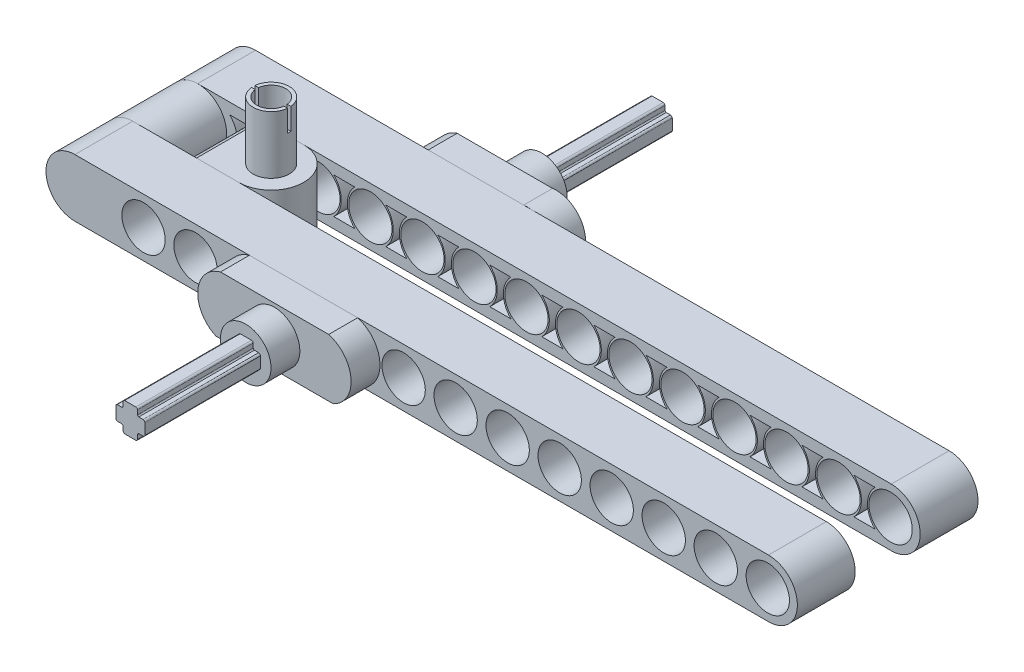
from build123d import *

# Parameters (mm, degrees)
BOSS_EXTRUDE1_DEPTH     = 8
SKETCH2_R               = 4
BOSS_EXTRUDE2_DEPTH     = 9
BOSS_EXTRUDE3_DEPTH     = 8
CUT_EXTRUDE4_DEPTH      = 55.854352608
CUT_EXTRUDE4_DEPTH_BACK = 55.854352608
SKETCH4_R               = 3
BOSS_EXTRUDE9_DEPTH     = 9
FILLET7_RADIUS          = 4.5
FILLET7_LENGTH          = 7.999994041
SKETCH33_R              = 2.5
SKETCH33_R_2            = 2
BOSS_EXTRUDE11_DEPTH    = 8
SKETCH34_W              = 5.22200927
SKETCH34_H              = 0.454292684
CUT_EXTRUDE17_DEPTH     = 3
BOSS_EXTRUDE12_DEPTH    = 4
BOSS_EXTRUDE16_DEPTH    = 4
SKETCH43_R              = 3.5
BOSS_EXTRUDE17_DEPTH    = 4
BOSS_EXTRUDE18_DEPTH    = 16
CUT_EXTRUDE18_DEPTH     = 2


with BuildPart() as part:
    # Sketch1 → Boss-Extrude1 (new body)
    with BuildSketch(Plane.XY):
        with BuildLine():
            Line((48, 4), (-48, 4))
            ThreePointArc((-48, 4), (-52, 0), (-48, -4))
            Line((-48, -4), (48, -4))
            ThreePointArc((48, -4), (52, 0), (48, 4))
        make_face()
    extrude(amount=-BOSS_EXTRUDE1_DEPTH)


with BuildPart() as body_2:
    # Sketch2 → Boss-Extrude2 (new body)
    with BuildSketch(Plane.XY):
        with Locations((-48, 0)):
            Circle(SKETCH2_R)
    extrude(amount=BOSS_EXTRUDE2_DEPTH)


with BuildPart() as body_3:
    # Sketch3 → Boss-Extrude3 (new body)
    with BuildSketch(Plane.XY.offset(9)):
        with BuildLine():
            Line((48, 4), (-48, 4))
            ThreePointArc((-48, 4), (-52, 0), (-48, -4))
            Line((-48, -4), (48, -4))
            ThreePointArc((48, -4), (52, 0), (48, 4))
        make_face()
    extrude(amount=BOSS_EXTRUDE3_DEPTH)


with BuildPart() as cut_extrude4_tool:
    # Sketch4 → Cut-Extrude4 (new, two sides: drawn at the far end of the back side and taken through both)
    with BuildSketch(Plane.XY.offset(-CUT_EXTRUDE4_DEPTH_BACK)):
        with Locations((-38.5, 0)):
            Circle(SKETCH4_R)
        with Locations((-31.3, 0)):
            Circle(SKETCH4_R)
        with Locations((-24.1, 0)):
            Circle(SKETCH4_R)
        with Locations((-16.9, 0)):
            Circle(SKETCH4_R)
        with Locations((-9.7, 0)):
            Circle(SKETCH4_R)
        with Locations((-2.5, 0)):
            Circle(SKETCH4_R)
        with Locations((4.7, 0)):
            Circle(SKETCH4_R)
        with Locations((11.9, 0)):
            Circle(SKETCH4_R)
        with Locations((19.1, 0)):
            Circle(SKETCH4_R)
        with Locations((26.3, 0)):
            Circle(SKETCH4_R)
        with Locations((33.5, 0)):
            Circle(SKETCH4_R)
        with Locations((40.7, 0)):
            Circle(SKETCH4_R)
        with Locations((47.9, 0)):
            Circle(SKETCH4_R)
    extrude(amount=CUT_EXTRUDE4_DEPTH + CUT_EXTRUDE4_DEPTH_BACK)


with BuildPart() as part_1:
    add(part.part)

    # Cut-Extrude4: cut by cut_extrude4_tool
    add(cut_extrude4_tool.part, mode=Mode.SUBTRACT)

    # Sketch12 → Cut-Extrude18 (cut)
    with BuildSketch(Plane.XY):
        with BuildLine():
            Line((-40.656780083, 2.479632802), (-43.571478062, 2.479632802))
            ThreePointArc((-43.571478062, 2.479632802), (-42.535944156, -0.020367198), (-43.571478062, -2.520367198))
            Line((-43.571478062, -2.520367198), (-40.656780083, -2.520367198))
            ThreePointArc((-40.656780083, -2.520367198), (-41.692313989, -0.020367198), (-40.656780083, 2.479632802))
        make_face()
        with BuildLine():
            Line((-33.456780083, 2.479632802), (-36.371478062, 2.479632802))
            ThreePointArc((-36.371478062, 2.479632802), (-35.335944156, -0.020367198), (-36.371478062, -2.520367198))
            Line((-36.371478062, -2.520367198), (-33.456780083, -2.520367198))
            ThreePointArc((-33.456780083, -2.520367198), (-34.492313989, -0.020367198), (-33.456780083, 2.479632802))
        make_face()
        with BuildLine():
            Line((-26.256780083, 2.479632802), (-29.171478062, 2.479632802))
            ThreePointArc((-29.171478062, 2.479632802), (-28.135944156, -0.020367198), (-29.171478062, -2.520367198))
            Line((-29.171478062, -2.520367198), (-26.256780083, -2.520367198))
            ThreePointArc((-26.256780083, -2.520367198), (-27.292313989, -0.020367198), (-26.256780083, 2.479632802))
        make_face()
        with BuildLine():
            Line((-19.056780083, 2.479632802), (-21.971478062, 2.479632802))
            ThreePointArc((-21.971478062, 2.479632802), (-20.935944156, -0.020367198), (-21.971478062, -2.520367198))
            Line((-21.971478062, -2.520367198), (-19.056780083, -2.520367198))
            ThreePointArc((-19.056780083, -2.520367198), (-20.092313989, -0.020367198), (-19.056780083, 2.479632802))
        make_face()
        with BuildLine():
            Line((-11.856780083, 2.479632802), (-14.771478062, 2.479632802))
            ThreePointArc((-14.771478062, 2.479632802), (-13.735944156, -0.020367198), (-14.771478062, -2.520367198))
            Line((-14.771478062, -2.520367198), (-11.856780083, -2.520367198))
            ThreePointArc((-11.856780083, -2.520367198), (-12.892313989, -0.020367198), (-11.856780083, 2.479632802))
        make_face()
        with BuildLine():
            Line((-4.656780083, 2.479632802), (-7.571478062, 2.479632802))
            ThreePointArc((-7.571478062, 2.479632802), (-6.535944156, -0.020367198), (-7.571478062, -2.520367198))
            Line((-7.571478062, -2.520367198), (-4.656780083, -2.520367198))
            ThreePointArc((-4.656780083, -2.520367198), (-5.692313989, -0.020367198), (-4.656780083, 2.479632802))
        make_face()
        with BuildLine():
            Line((2.543219917, 2.479632802), (-0.371478062, 2.479632802))
            ThreePointArc((-0.371478062, 2.479632802), (0.664055844, -0.020367198), (-0.371478062, -2.520367198))
            Line((-0.371478062, -2.520367198), (2.543219917, -2.520367198))
            ThreePointArc((2.543219917, -2.520367198), (1.507686011, -0.020367198), (2.543219917, 2.479632802))
        make_face()
        with BuildLine():
            Line((9.743219917, 2.479632802), (6.828521938, 2.479632802))
            ThreePointArc((6.828521938, 2.479632802), (7.864055844, -0.020367198), (6.828521938, -2.520367198))
            Line((6.828521938, -2.520367198), (9.743219917, -2.520367198))
            ThreePointArc((9.743219917, -2.520367198), (8.707686011, -0.020367198), (9.743219917, 2.479632802))
        make_face()
        with BuildLine():
            Line((16.943219917, 2.479632802), (14.028521938, 2.479632802))
            ThreePointArc((14.028521938, 2.479632802), (15.064055844, -0.020367198), (14.028521938, -2.520367198))
            Line((14.028521938, -2.520367198), (16.943219917, -2.520367198))
            ThreePointArc((16.943219917, -2.520367198), (15.907686011, -0.020367198), (16.943219917, 2.479632802))
        make_face()
        with BuildLine():
            Line((24.143219917, 2.479632802), (21.228521938, 2.479632802))
            ThreePointArc((21.228521938, 2.479632802), (22.264055844, -0.020367198), (21.228521938, -2.520367198))
            Line((21.228521938, -2.520367198), (24.143219917, -2.520367198))
            ThreePointArc((24.143219917, -2.520367198), (23.107686011, -0.020367198), (24.143219917, 2.479632802))
        make_face()
        with BuildLine():
            Line((31.343219917, 2.479632802), (28.428521938, 2.479632802))
            ThreePointArc((28.428521938, 2.479632802), (29.464055844, -0.020367198), (28.428521938, -2.520367198))
            Line((28.428521938, -2.520367198), (31.343219917, -2.520367198))
            ThreePointArc((31.343219917, -2.520367198), (30.307686011, -0.020367198), (31.343219917, 2.479632802))
        make_face()
        with BuildLine():
            Line((38.543219917, 2.479632802), (35.628521938, 2.479632802))
            ThreePointArc((35.628521938, 2.479632802), (36.664055844, -0.020367198), (35.628521938, -2.520367198))
            Line((35.628521938, -2.520367198), (38.543219917, -2.520367198))
            ThreePointArc((38.543219917, -2.520367198), (37.507686011, -0.020367198), (38.543219917, 2.479632802))
        make_face()
        with BuildLine():
            Line((45.743219917, 2.479632802), (42.828521938, 2.479632802))
            ThreePointArc((42.828521938, 2.479632802), (43.864055844, -0.020367198), (42.828521938, -2.520367198))
            Line((42.828521938, -2.520367198), (45.743219917, -2.520367198))
            ThreePointArc((45.743219917, -2.520367198), (44.707686011, -0.020367198), (45.743219917, 2.479632802))
        make_face()
    extrude(amount=-CUT_EXTRUDE18_DEPTH, mode=Mode.SUBTRACT)


with BuildPart() as body_3_1:
    add(body_3.part)

    # Cut-Extrude4: cut by cut_extrude4_tool
    add(cut_extrude4_tool.part, mode=Mode.SUBTRACT)


with BuildPart() as body_4:
    # Sketch32 → Boss-Extrude9 (new body)
    with BuildSketch(Plane.XY):
        with BuildLine():
            Line((-28.828371405, 3.999994041), (-39.160506587, 3.999994041))
            ThreePointArc((-39.160506587, 3.999994041), (-41.644107195, -2.979e-06), (-39.160506587, -4))
            Line((-39.160506587, -4), (-28.828371405, -4))
            Line((-28.828371405, -4), (-28.828371405, 3.999994041))
        make_face()
    extrude(amount=BOSS_EXTRUDE9_DEPTH)

    # Fillet7: full round fillet: the end face becomes a half cylinder, R = half its width
    fillet7_face = Plane((-28.828371405, -2.979e-06, 4.5), x_dir=(0, -1, 0), z_dir=(1, 0, 0))  # on the end face: x along it, z out of the body
    fillet7_slab = fillet7_face.offset(-FILLET7_RADIUS / 2) * Box(FILLET7_LENGTH, 2 * FILLET7_RADIUS, FILLET7_RADIUS, mode=Mode.PRIVATE)  # the body's end, R deep
    fillet7_round = Plane((-33.328371405, -2.979e-06, 4.5), x_dir=(1, 0, 0), z_dir=(0, -1, 0)) * Cylinder(FILLET7_RADIUS, FILLET7_LENGTH, mode=Mode.PRIVATE)  # its axis R under the face
    add(fillet7_slab - fillet7_round, mode=Mode.SUBTRACT)

    # Sketch33 → Boss-Extrude11 (add)
    with BuildSketch(Plane(origin=(0, 3.999994041, 0), x_dir=(1, 0, 0), z_dir=(0, 1, 0))):
        with Locations(Location((-33.328371405, -4.5, 0), (0, 0, 90))):
            Circle(SKETCH33_R)
        with Locations(Location((-33.328371405, -4.5, 0), (0, 0, 270))):
            Circle(SKETCH33_R_2, mode=Mode.SUBTRACT)
    extrude(amount=BOSS_EXTRUDE11_DEPTH)

    # Sketch34 → Cut-Extrude17 (cut)
    with BuildSketch(Plane(origin=(0, 11.999994041, 0), x_dir=(1, 0, 0), z_dir=(0, 1, 0))):
        with Locations((-33.328371405, -4.5)):
            Rectangle(SKETCH34_W, SKETCH34_H)
    extrude(amount=-CUT_EXTRUDE17_DEPTH, mode=Mode.SUBTRACT)


with BuildPart() as body_5:
    # Sketch36 → Boss-Extrude12 (new body)
    with BuildSketch(Plane(origin=(0, 0, -8), x_dir=(-1, 0, 0), z_dir=(0, 0, -1))):
        with BuildLine():
            Line((10.888935538, 4), (24.1, 4))
            ThreePointArc((24.1, 4), (27.050355877, 0), (24.1, -4))
            Line((24.1, -4), (10.888935538, -4))
            ThreePointArc((10.888935538, -4), (6.323698488, 0), (10.888935538, 4))
        make_face()
    extrude(amount=BOSS_EXTRUDE12_DEPTH)


with BuildPart() as body_6:
    # Sketch41 → Boss-Extrude16 (new body)
    with BuildSketch(Plane.XY.offset(17)):
        with BuildLine():
            Line((-23.850279243, 4), (-8.871558086, 4))
            ThreePointArc((-8.871558086, 4), (-5.782338955, 0.213850083), (-8.256540547, -4))
            Line((-8.256540547, -4), (-24.487501805, -4))
            ThreePointArc((-24.487501805, -4), (-26.984615845, 0.224280463), (-23.850279243, 4))
        make_face()
    extrude(amount=BOSS_EXTRUDE16_DEPTH)


with BuildPart() as body_7:
    # Sketch43 → Boss-Extrude17 (new body)
    with BuildSketch(Plane.XY.offset(21)):
        with Locations((-16.360918665, 0)):
            Circle(SKETCH43_R)
    extrude(amount=BOSS_EXTRUDE17_DEPTH)


with BuildPart() as body_8:
    # Sketch44 → Boss-Extrude18 (new body)
    with BuildSketch(Plane.XY.offset(25)):
        with BuildLine():
            Line((-17.474999685, 0.965560484), (-18.142474483, 0.965560484))
            ThreePointArc((-18.142474483, 0.965560484), (-18.265784842, 0.892449924), (-18.316322854, 0.75829886))
            Line((-18.316322854, 0.75829886), (-18.316322854, -0.864246456))
            ThreePointArc((-18.316322854, -0.864246456), (-18.255585898, -0.976092562), (-18.142474616, -1.034439516))
            Line((-18.142474616, -1.034439516), (-17.512989962, -1.034439516))
            ThreePointArc((-17.512989962, -1.034439516), (-17.387738252, -1.089838685), (-17.320844923, -1.209347434))
            Line((-17.320844923, -1.209347434), (-17.320844923, -1.780819296))
            ThreePointArc((-17.320844923, -1.780819296), (-17.229988993, -1.96501419), (-17.03813971, -2.038338206))
            Line((-17.03813971, -2.038338206), (-15.59179381, -2.038338206))
            ThreePointArc((-15.59179381, -2.038338206), (-15.408251275, -1.968284883), (-15.318059839, -1.793754556))
            Line((-15.318059839, -1.793754556), (-15.318059839, -1.218889714))
            ThreePointArc((-15.318059839, -1.218889714), (-15.257787164, -1.096917069), (-15.136621661, -1.035037811))
            Line((-15.136621661, -1.035037811), (-14.529276658, -1.035037811))
            ThreePointArc((-14.529276658, -1.035037811), (-14.385909809, -0.961662103), (-14.315650705, -0.81674245))
            Line((-14.315650705, -0.81674245), (-14.315650705, 0.71481867))
            ThreePointArc((-14.315650705, 0.71481867), (-14.40347584, 0.87813568), (-14.5670075, 0.965560484))
            Line((-14.5670075, 0.965560484), (-15.159529071, 0.965560484))
            ThreePointArc((-15.159529071, 0.965560484), (-15.266776528, 1.032790097), (-15.318059839, 1.148513301))
            Line((-15.318059839, 1.148513301), (-15.318059839, 1.731888353))
            ThreePointArc((-15.318059839, 1.731888353), (-15.399816947, 1.891736636), (-15.565114554, 1.961825148))
            Line((-15.565114554, 1.961825148), (-17.123649134, 1.961825148))
            ThreePointArc((-17.123649134, 1.961825148), (-17.254113822, 1.88447148), (-17.320844923, 1.748267278))
            Line((-17.320844923, 1.748267278), (-17.320844923, 1.117011275))
            ThreePointArc((-17.320844923, 1.117011275), (-17.377659539, 1.020661348), (-17.474999685, 0.965560484))
        make_face()
    extrude(amount=BOSS_EXTRUDE18_DEPTH)


with BuildPart() as body_9:
    # Mirror3: mirrored copy
    add(body_8.part.mirror(Plane(origin=(0, 0, 4.5), x_dir=(1, 0, 0), z_dir=(0, 0, -1))))


with BuildPart() as body_10:
    # Mirror4: mirrored copy
    add(body_7.part.mirror(Plane(origin=(0, 0, 4.5), x_dir=(1, 0, 0), z_dir=(0, 0, -1))))


solid = Compound([body_2.part, part_1.part, body_3_1.part, body_4.part, body_5.part, body_6.part, body_7.part, body_8.part, body_9.part, body_10.part])
